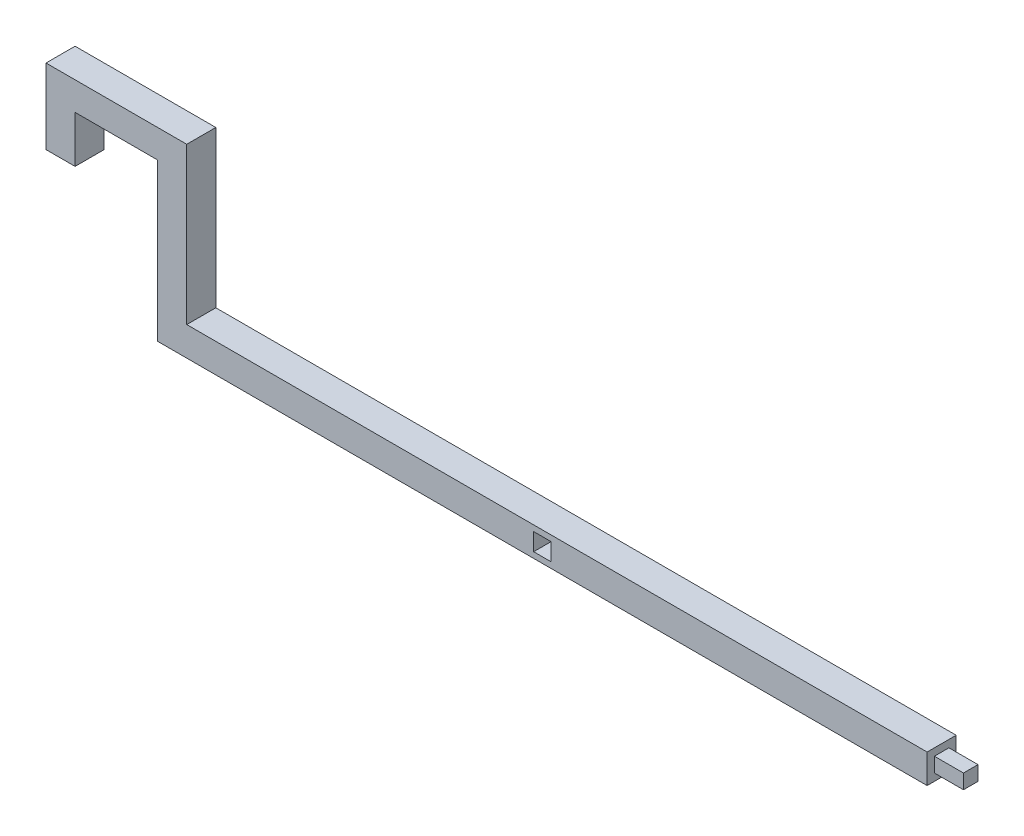
from build123d import *

# Parameters (mm, degrees)
BOSS_EXTRUDE1_DEPTH = 5
SKETCH2_W           = 2.5
SKETCH2_H           = 2.5
BOSS_EXTRUDE2_DEPTH = 5
SKETCH3_W           = 3
SKETCH3_H           = 3
CUT_EXTRUDE1_DEPTH  = 21


with BuildPart() as part:
    # Sketch1 → Boss-Extrude1 (new body)
    with BuildSketch(Plane.XY):
        Polygon((0, 6.7), (0, 8.05), (5.5, 8.05), (14.2, 8.05), (14.2, -18.95), (146.5, -18.95), (146.5, -13.95), (19.2, -13.95), (19.2, 12.9), (5.5, 12.9), (-5, 12.9), (-5, 0), (0, 0), align=None)
    extrude(amount=BOSS_EXTRUDE1_DEPTH)

    # Sketch2 → Boss-Extrude2 (add)
    with BuildSketch(Plane(origin=(146.5, 0, 0), x_dir=(0, 0, -1), z_dir=(1, 0, 0))):
        with Locations((-2.5, -16.45)):
            Rectangle(SKETCH2_W, SKETCH2_H)
    extrude(amount=BOSS_EXTRUDE2_DEPTH)

    # Sketch3 → Cut-Extrude1 (cut)
    with BuildSketch(Plane.XY.offset(5)):
        with Locations((80.35, -16.45)):
            Rectangle(SKETCH3_W, SKETCH3_H)
    extrude(amount=-CUT_EXTRUDE1_DEPTH, mode=Mode.SUBTRACT)


solid = part.part
